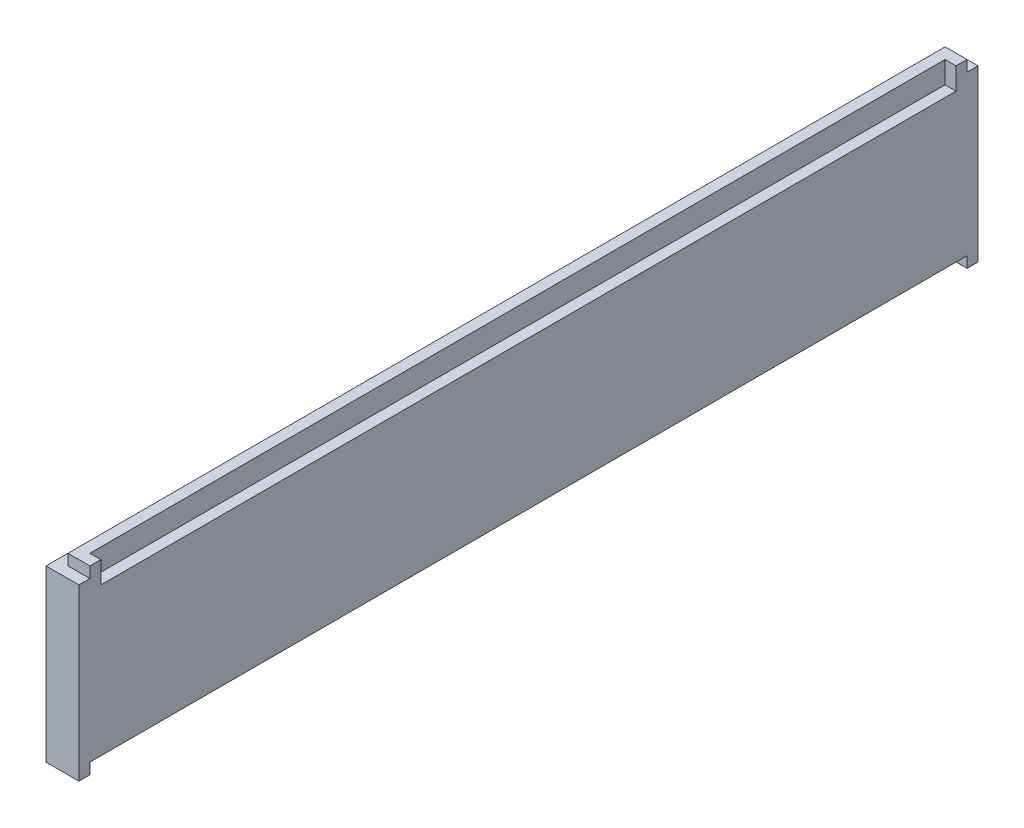
from build123d import *

# Parameters (mm, degrees)
EXTRUDE_1_DEPTH     = 820
SKETCH_2_W          = 10
SKETCH_2_H          = 10
EXTRUDE_2_DEPTH     = 20
SKETCH_4_W          = 20
SKETCH_4_H          = 20
EXTRUDE_3_DEPTH     = 10
SKETCH_5_W          = 10
SKETCH_5_H          = 10
CUT_EXTRUDE_2_DEPTH = 837.973715238


with BuildPart() as part:
    # Эскиз1 → Бобышка-Вытянуть1 (new body)
    with BuildSketch(Plane.XY):
        Polygon((0, 0), (0, 155), (10, 155), (10, 165), (20, 165), (20, 145), (30, 145), (30, 10), (10, 10), (10, 0), align=None)
    extrude(amount=EXTRUDE_1_DEPTH)

    # Эскиз2 → Бобышка-Вытянуть2 (add)
    with BuildSketch(Plane(origin=(10, 0, 0), x_dir=(0, 0, -1), z_dir=(1, 0, 0))):
        with Locations((-815, 5)):
            Rectangle(SKETCH_2_W, SKETCH_2_H)
        with Locations((-5, 5)):
            Rectangle(SKETCH_2_W, SKETCH_2_H)
    extrude(amount=EXTRUDE_2_DEPTH)

    # Эскиз4 → Бобышка-Вытянуть3 (add)
    with BuildSketch(Plane(origin=(20, 0, 0), x_dir=(0, 0, -1), z_dir=(1, 0, 0))):
        with Locations((-810, 155)):
            Rectangle(SKETCH_4_W, SKETCH_4_H)
        with Locations((-10, 155)):
            Rectangle(SKETCH_4_W, SKETCH_4_H)
    extrude(amount=EXTRUDE_3_DEPTH)

    # Эскиз5 → Вырез-Вытянуть2 (cut, through all)
    with BuildSketch(Plane(origin=(30, 0, 0), x_dir=(0, 0, -1), z_dir=(1, 0, 0))):
        with Locations((-815, 160)):
            Rectangle(SKETCH_5_W, SKETCH_5_H)
        with Locations((-5, 160)):
            Rectangle(SKETCH_5_W, SKETCH_5_H)
    extrude(amount=-CUT_EXTRUDE_2_DEPTH, mode=Mode.SUBTRACT)


solid = part.part
